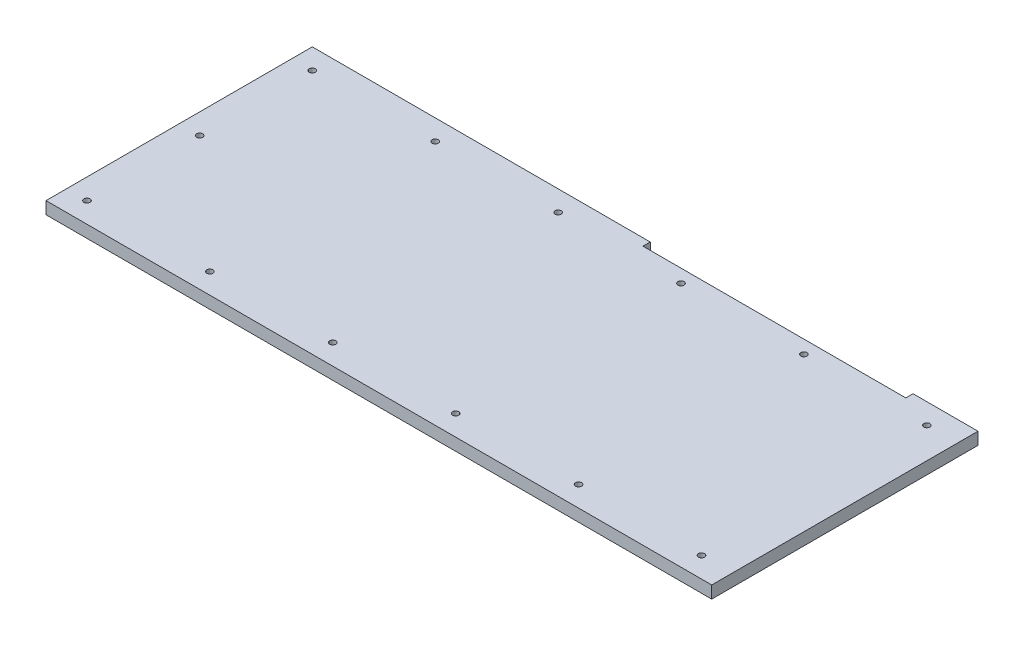
from build123d import *

# Parameters (mm, degrees)
SKETCH_1_R      = 1.5
EXTRUDE_1_DEPTH = 6


with BuildPart() as part:
    # 草图1 → 凸台-拉伸1 (new body)
    with BuildSketch(Plane(origin=(0, 0, 0), x_dir=(1, 0, 0), z_dir=(0, 1, 0))):
        Polygon((-162.5, 65), (2.497803149, 65), (2.497803149, 61.454616174), (130.785768407, 61.454616174), (130.785768407, 65), (162.5, 65), (162.5, -65), (-162.5, -65), align=None)
        with Locations(Location((-152.5, 55, 0), (0, 0, 270))):
            Circle(SKETCH_1_R, mode=Mode.SUBTRACT)
        with Locations(Location((-152.5, -55, 0), (0, 0, 270))):
            Circle(SKETCH_1_R, mode=Mode.SUBTRACT)
        with Locations(Location((-92.5, 55, 0), (0, 0, 270))):
            Circle(SKETCH_1_R, mode=Mode.SUBTRACT)
        with Locations(Location((-32.5, 55, 0), (0, 0, 270))):
            Circle(SKETCH_1_R, mode=Mode.SUBTRACT)
        with Locations(Location((27.5, 55, 0), (0, 0, 270))):
            Circle(SKETCH_1_R, mode=Mode.SUBTRACT)
        with Locations(Location((87.5, 55, 0), (0, 0, 270))):
            Circle(SKETCH_1_R, mode=Mode.SUBTRACT)
        with Locations(Location((147.5, 55, 0), (0, 0, 270))):
            Circle(SKETCH_1_R, mode=Mode.SUBTRACT)
        with Locations(Location((-92.5, -55, 0), (0, 0, 270))):
            Circle(SKETCH_1_R, mode=Mode.SUBTRACT)
        with Locations(Location((-32.5, -55, 0), (0, 0, 270))):
            Circle(SKETCH_1_R, mode=Mode.SUBTRACT)
        with Locations(Location((27.5, -55, 0), (0, 0, 270))):
            Circle(SKETCH_1_R, mode=Mode.SUBTRACT)
        with Locations(Location((87.5, -55, 0), (0, 0, 270))):
            Circle(SKETCH_1_R, mode=Mode.SUBTRACT)
        with Locations(Location((147.5, -55, 0), (0, 0, 270))):
            Circle(SKETCH_1_R, mode=Mode.SUBTRACT)
        with Locations(Location((-152.5, 0, 0), (0, 0, 270))):
            Circle(SKETCH_1_R, mode=Mode.SUBTRACT)
    extrude(amount=EXTRUDE_1_DEPTH)


solid = part.part
